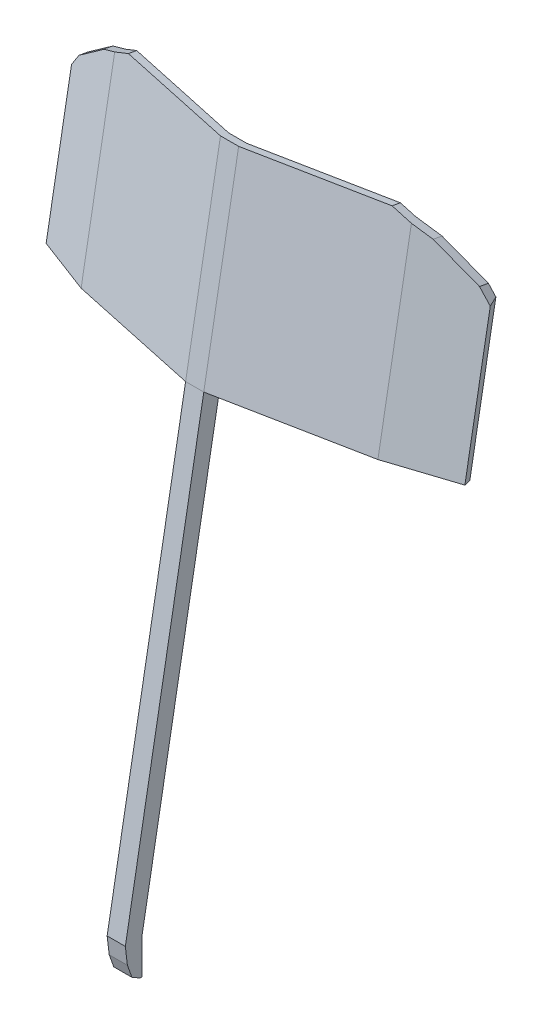
from build123d import *

# Parameters (mm, degrees)
SKETCH3_W                = 11
SKETCH3_H                = 21
BOSS_EXTRUDE1_DEPTH      = 10
CUT_EXTRUDE1_DEPTH       = 8
CUT_EXTRUDE5_DEPTH       = 8
CUT_EXTRUDE5_DEPTH_BACK  = 8
BOSS_EXTRUDE2_DEPTH      = 5.5
BOSS_EXTRUDE2_DEPTH_BACK = 5.5
BOSS_EXTRUDE6_DEPTH      = 120
CUT_EXTRUDE6_DEPTH       = 120


with BuildPart() as part:
    # Sketch3 → Boss-Extrude1 (new body)
    with BuildSketch(Plane.XY):
        Rectangle(SKETCH3_W, SKETCH3_H)
    extrude(amount=BOSS_EXTRUDE1_DEPTH)

    # Sketch5 → Cut-Extrude1 (cut)
    with BuildSketch(Plane.XY):
        Polygon((0, 1.5), (-2, 1.5), (-2, -1.5), (2, -1.5), (2, 1.5), align=None)
    extrude(amount=CUT_EXTRUDE1_DEPTH, mode=Mode.SUBTRACT)

    # Sketch6 → Cut-Extrude5 (cut, two sides: drawn at the far end of the back side and taken through both)
    with BuildSketch(Plane(origin=(0, 0, 0), x_dir=(0, 0, -1), z_dir=(1, 0, 0)).offset(-CUT_EXTRUDE5_DEPTH_BACK)):
        Polygon((-1.0867085, -10.5), (-6.011599163, -7.693477847), (-8.753565317, 0), (-10, 10.5), (-10, -10.5), (-10, -11.324459918), (-1.0867085, -10.760658811), align=None)
    extrude(amount=CUT_EXTRUDE5_DEPTH + CUT_EXTRUDE5_DEPTH_BACK, mode=Mode.SUBTRACT)

    # Sketch18 → Boss-Extrude2 (add, two sides: drawn at the far end of the back side and taken through both)
    with BuildSketch(Plane(origin=(0, 0, 0), x_dir=(0, 0, -1), z_dir=(1, 0, 0)).offset(-BOSS_EXTRUDE2_DEPTH_BACK)):
        Polygon((0, 10.5), (47.274579224, 275.316482995), (37.430212914, 277.073882193), (-10, 10.5), align=None)
    extrude(amount=BOSS_EXTRUDE2_DEPTH + BOSS_EXTRUDE2_DEPTH_BACK)

    # Sketch20 → Boss-Extrude6 (add)
    with BuildSketch(Plane(origin=(0, 274.99219554, -49.091129779), x_dir=(1, 0, 0), z_dir=(0, 0.9844366310526066, -0.17573991988673054))):
        Polygon((5.5, -11.845269159), (89.722424634, 9.543427454), (126.59891896, 25.507030725), (124.938057952, 30.22777974), (87.652020554, 14.094628059), (5.5, -6.845269159), (-5.5, -6.845269159), (-87.652020554, 14.094628059), (-124.938057952, 30.22777974), (-126.59891896, 25.507030725), (-89.722424634, 9.543427454), (-5.5, -11.845269159), align=None)
    extrude(amount=BOSS_EXTRUDE6_DEPTH)

    # Sketch23 → Cut-Extrude6 (cut)
    with BuildSketch(Plane(origin=(0, 3.839085852, 21.505283175), x_dir=(1, 0, 0), z_dir=(0, 0.17573991988673054, 0.9844366310526066))):
        Polygon((-5.5, 419.339661758), (-1.559239103, 421.572876694), (-44.351514871, 435.559129211), (-45.770075722, 435.559129211), (-131.689368664, 409.111534998), (-185.542931008, 339.339661758), (-131.689368664, 359.582766362), (-121.100925347, 374.450322533), (-99.48017922, 390.223948639), (-79.722424634, 399.339661758), align=None)
        Polygon((5.5, 419.339661758), (79.722424634, 399.339661758), (99.48017922, 390.223948639), (121.100925347, 374.450322533), (131.689368664, 359.582766362), (185.542931008, 339.339661758), (131.689368664, 409.111534998), (45.770075722, 435.559129211), (44.351514871, 435.559129211), (1.559239103, 421.572876694), align=None)
    extrude(amount=-CUT_EXTRUDE6_DEPTH, mode=Mode.SUBTRACT)


solid = part.part
